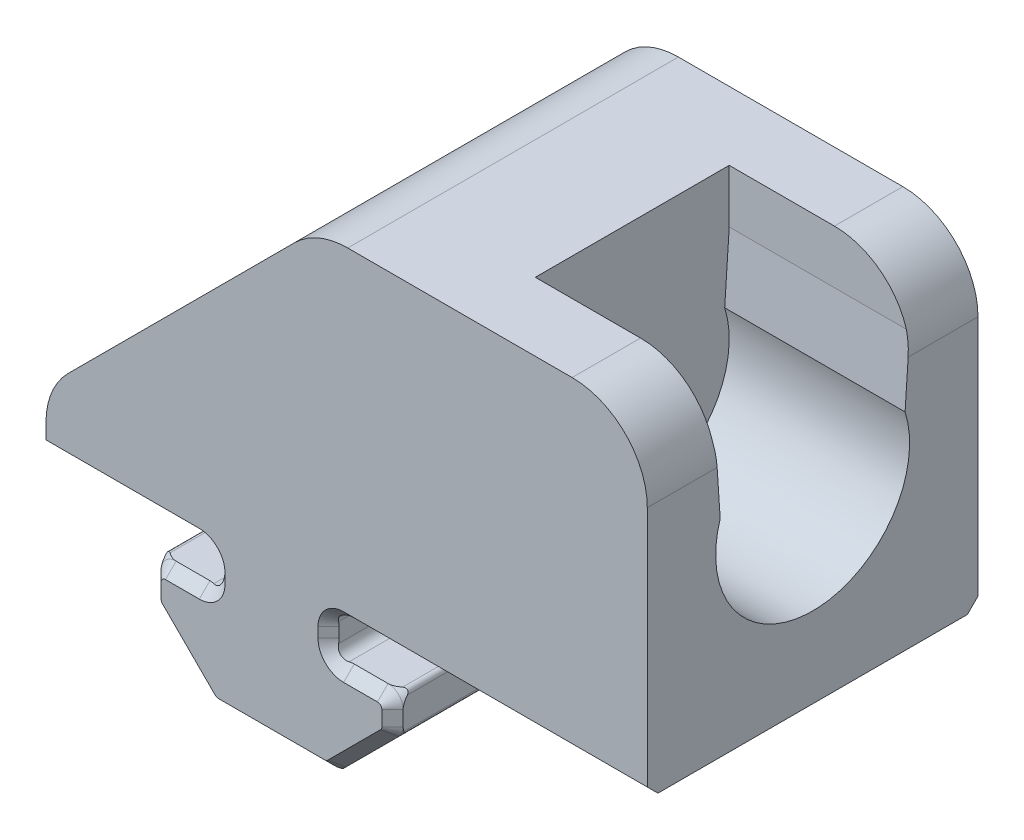
from build123d import *

# Parameters (mm, degrees)
BOSS_EXTRUDE1_DEPTH = 22
CUT_EXTRUDE1_DEPTH  = 12
CHAMFER1_SIZE       = 18
FILLET1_R           = 5
FILLET2_R           = 5


with BuildPart() as part:
    # Sketch2 → Boss-Extrude1 (new body)
    with BuildSketch(Plane.XY):
        with BuildLine():
            Line((14.99994, 31.165268255), (24.99994, 31.165268255))
            Line((24.99994, 31.165268255), (24.99994, 9.365268255))
            Line((24.99994, 9.365268255), (14.99994, 9.365268255))
            Line((14.99994, 9.365268255), (12.999948, 9.365268255))
            Line((12.999948, 9.365268255), (4.5, 9.365268255))
            ThreePointArc((4.5, 9.365268255), (4.005025253, 9.160243002), (3.8, 8.665268255))
            Line((3.8, 8.665268255), (3.8, 7.407802905))
            ThreePointArc((3.8, 7.407802905), (4.005025253, 6.912828158), (4.5, 6.707802905))
            Line((4.5, 6.707802905), (7.736453928, 6.707802905))
            ThreePointArc((7.736453928, 6.707802905), (7.957266257, 6.624965773), (8.049967, 6.408109491))
            Line((8.049967, 6.408109491), (8.049967, 4.425516287))
            ThreePointArc((8.049967, 4.425516287), (8.027131012, 4.310712023), (7.96209962, 4.213385667))
            Line((7.96209962, 4.213385667), (4.036581333, 0.28786738))
            ThreePointArc((4.036581333, 0.28786738), (3.939254977, 0.222835988), (3.824450713, 0.2))
            Line((3.824450713, 0.2), (-3.824450713, 0.2))
            ThreePointArc((-3.824450713, 0.2), (-3.939254977, 0.222835988), (-4.036581333, 0.28786738))
            Line((-4.036581333, 0.28786738), (-7.96209962, 4.213385667))
            ThreePointArc((-7.96209962, 4.213385667), (-8.027131012, 4.310712023), (-8.049967, 4.425516287))
            Line((-8.049967, 4.425516287), (-8.049967, 6.408109491))
            ThreePointArc((-8.049967, 6.408109491), (-7.957266257, 6.624965773), (-7.736453928, 6.707802905))
            Line((-7.736453928, 6.707802905), (-4.5, 6.707802905))
            ThreePointArc((-4.5, 6.707802905), (-4.005025253, 6.912828158), (-3.8, 7.407802905))
            Line((-3.8, 7.407802905), (-3.8, 8.665268255))
            ThreePointArc((-3.8, 8.665268255), (-4.005025253, 9.160243002), (-4.5, 9.365268255))
            Line((-4.5, 9.365268255), (-12.999948, 9.365268255))
            Line((-12.999948, 9.365268255), (-14.99994, 9.365268255))
            Line((-14.99994, 9.365268255), (-14.99994, 31.165268255))
            Line((-14.99994, 31.165268255), (14.99994, 31.165268255))
        make_face()
    extrude(amount=BOSS_EXTRUDE1_DEPTH)

    # Sketch3 → Cut-Extrude1 (cut)
    with BuildSketch(Plane(origin=(24.99994, 0, 0), x_dir=(0, 0, -1), z_dir=(1, 0, 0))):
        with BuildLine():
            Line((-17.45, 31.165268255), (-4.55, 31.165268255))
            Line((-4.55, 31.165268255), (-4.55, 27.615268255))
            Line((-4.55, 27.615268255), (-4.85, 23.109490465))
            ThreePointArc((-4.85, 23.109490465), (-11, 14.715268255), (-17.15, 23.109490465))
            Line((-17.15, 23.109490465), (-17.45, 27.615268255))
            Line((-17.45, 27.615268255), (-17.45, 31.165268255))
        make_face()
    extrude(amount=-CUT_EXTRUDE1_DEPTH, mode=Mode.SUBTRACT)

    # Chamfer1
    chamfer1_edges = [part.edges().sort_by_distance(p)[0] for p in [
        (-14.99994, 31.165268255, 11),
    ]]
    chamfer(chamfer1_edges, length=CHAMFER1_SIZE)

    # Fillet1
    fillet1_edges = [part.edges().sort_by_distance(p)[0] for p in [
        (-14.99994, 13.165268255, 11),
        (3.00006, 31.165268255, 11),
    ]]
    fillet(fillet1_edges, radius=FILLET1_R)

    # Fillet2
    fillet2_edges = [part.edges().sort_by_distance(p)[0] for p in [
        (24.99994, 31.165268255, 2.275),
        (24.99994, 31.165268255, 19.725),
    ]]
    fillet(fillet2_edges, radius=FILLET2_R)

    # Cut-Sweep7: sweep along a path in Sketch43
    with BuildLine(Plane.XY.offset(22)) as cut_sweep7_path:
        Line((-14.99994, 9.365268255), (-4.8, 9.365268255))
        ThreePointArc((-4.8, 9.365268255), (-4.092893219, 9.072375036), (-3.8, 8.365268255))
        Line((-3.8, 8.365268255), (-3.8, 7.707802905))
        ThreePointArc((-3.8, 7.707802905), (-4.092893219, 7.000696124), (-4.8, 6.707802905))
        Line((-4.8, 6.707802905), (-7.049967, 6.707802905))
        ThreePointArc((-7.049967, 6.707802905), (-7.757073781, 6.414909686), (-8.049967, 5.707802905))
        Line((-8.049967, 5.707802905), (-8.049967, 4.715466609))
        ThreePointArc((-8.049967, 4.715466609), (-7.973846533, 4.332783177), (-7.757073781, 4.008359828))
        Line((-7.757073781, 4.008359828), (-4.241607172, 0.492893219))
        ThreePointArc((-4.241607172, 0.492893219), (-3.917183823, 0.276120467), (-3.534500391, 0.2))
        Line((-3.534500391, 0.2), (3.534500391, 0.2))
        ThreePointArc((3.534500391, 0.2), (3.917183823, 0.276120467), (4.241607172, 0.492893219))
        Line((4.241607172, 0.492893219), (7.757073781, 4.008359828))
        ThreePointArc((7.757073781, 4.008359828), (7.973846533, 4.332783177), (8.049967, 4.715466609))
        Line((8.049967, 4.715466609), (8.049967, 5.707802905))
        ThreePointArc((8.049967, 5.707802905), (7.757073781, 6.414909686), (7.049967, 6.707802905))
        Line((7.049967, 6.707802905), (4.8, 6.707802905))
        ThreePointArc((4.8, 6.707802905), (4.092893219, 7.000696124), (3.8, 7.707802905))
        Line((3.8, 7.707802905), (3.8, 8.365268255))
        ThreePointArc((3.8, 8.365268255), (4.092893219, 9.072375036), (4.8, 9.365268255))
        Line((4.8, 9.365268255), (14.99994, 9.365268255))
        Line((14.99994, 9.365268255), (24.99994, 9.365268255))
    # Sketch4 → Cut-Sweep7 (sweep, cut)
    with BuildSketch(Plane.ZY.offset(14.99994)):
        Polygon((22, 10.072375036), (22.707106781, 9.365268255), (22, 8.658161474), (20.776291928, 8.963134662), (21.292893219, 9.365268255), align=None)
    cut_sweep7 = sweep(path=cut_sweep7_path.line, mode=Mode.SUBTRACT)

    # Mirror1: Cut-Sweep7 across plane
    add(cut_sweep7.mirror(Plane(origin=(0, 0, 11), x_dir=(1, 0, 0), z_dir=(0, 0, -1))), mode=Mode.SUBTRACT)


solid = part.part
